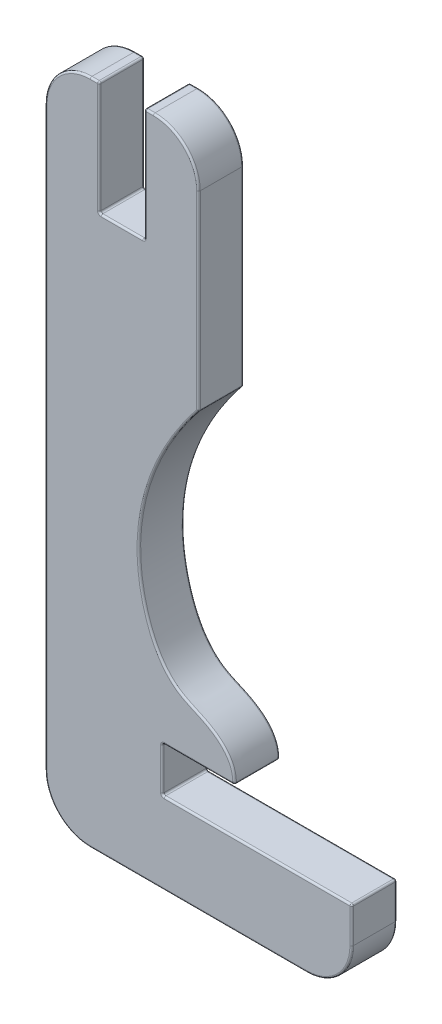
from build123d import *

# Parameters (mm, degrees)
RESSALTO_EXTRUS_O1_DEPTH = 2.5
FILETE1_R                = 0.1


with BuildPart() as part:
    # Esboço1 → Ressalto-extrusão1 (new body)
    with BuildSketch(Plane.XY):
        with BuildLine():
            Line((-99.459703088, 15.410981147), (-99.459703088, 4.861348653))
            add(Edge.make_bspline(
                [(-97.459703088, -12.089018853), (-97.404624741, -10.991450722), (-98.658271178, -9.90481113), (-101.30414524, -8.990765832), (-103.915821362, -3.231494779), (-101.9905843, 1.708849959), (-99.459703088, 4.861348653)],
                knots=[0, 0, 0, 0, 0.150348542, 0.226705439, 0.420401921, 1, 1, 1, 1], degree=3))
            Line((-97.459703088, -12.089018853), (-101.459703088, -12.089018853))
            Line((-101.459703088, -12.089018853), (-101.459703088, -14.589018853))
            Line((-101.459703088, -14.589018853), (-90.959703088, -14.589018853))
            Line((-90.959703088, -14.589018853), (-90.959703088, -16.589018853))
            ThreePointArc((-90.959703088, -16.589018853), (-91.691936135, -18.356785806), (-93.459703088, -19.089018853))
            Line((-93.459703088, -19.089018853), (-105.459703088, -19.089018853))
            ThreePointArc((-105.459703088, -19.089018853), (-107.227470041, -18.356785806), (-107.959703088, -16.589018853))
            Line((-107.959703088, -16.589018853), (-107.959703088, 15.410981147))
            ThreePointArc((-107.959703088, 15.410981147), (-107.227470041, 17.1787481), (-105.459703088, 17.910981147))
            Line((-105.459703088, 17.910981147), (-104.959703088, 17.910981147))
            Line((-104.959703088, 17.910981147), (-104.959703088, 11.610981147))
            Line((-104.959703088, 11.610981147), (-102.459703088, 11.610981147))
            Line((-102.459703088, 11.610981147), (-102.459703088, 17.910981147))
            Line((-102.459703088, 17.910981147), (-101.959703088, 17.910981147))
            ThreePointArc((-101.959703088, 17.910981147), (-100.191936135, 17.1787481), (-99.459703088, 15.410981147))
        make_face()
    extrude(amount=RESSALTO_EXTRUS_O1_DEPTH)

    # Filete1
    filete1_edges = [part.edges().sort_by_distance(p)[0] for p in [
        (-102.459703088, 14.760981147, 2.5),
        (-103.709703088, 11.610981147, 2.5),
        (-99.459703088, 10.1361649, 0),
        (-102.723921949, -4.322739517, 0),
        (-99.459703088, -12.089018853, 0),
        (-104.959703088, 14.760981147, 2.5),
        (-101.459703088, -13.339018853, 0),
        (-96.209703088, -14.589018853, 0),
        (-90.959703088, -15.589018853, 0),
        (-91.691936135, -18.356785806, 0),
        (-99.459703088, -19.089018853, 0),
        (-107.227470041, -18.356785806, 0),
        (-107.959703088, -0.589018853, 0),
        (-107.227470041, 17.1787481, 0),
        (-105.209703088, 17.910981147, 2.5),
        (-105.209703088, 17.910981147, 0),
        (-104.959703088, 14.760981147, 0),
        (-103.709703088, 11.610981147, 0),
        (-102.459703088, 14.760981147, 0),
        (-102.209703088, 17.910981147, 0),
        (-100.191936135, 17.1787481, 0),
        (-107.227470041, 17.1787481, 2.5),
        (-107.959703088, -0.589018853, 2.5),
        (-99.459703088, 4.861348653, 1.25),
        (-97.459703088, -12.089018853, 1.25),
        (-101.459703088, -12.089018853, 1.25),
        (-101.459703088, -14.589018853, 1.25),
        (-90.959703088, -14.589018853, 1.25),
        (-107.227470041, -18.356785806, 2.5),
        (-104.959703088, 17.910981147, 1.25),
        (-104.959703088, 11.610981147, 1.25),
        (-102.459703088, 11.610981147, 1.25),
        (-102.459703088, 17.910981147, 1.25),
        (-99.459703088, -19.089018853, 2.5),
        (-91.691936135, -18.356785806, 2.5),
        (-90.959703088, -15.589018853, 2.5),
        (-100.191936135, 17.1787481, 2.5),
        (-96.209703088, -14.589018853, 2.5),
        (-101.459703088, -13.339018853, 2.5),
        (-99.459703088, -12.089018853, 2.5),
        (-102.723921949, -4.322739517, 2.5),
        (-99.459703088, 10.1361649, 2.5),
        (-102.209703088, 17.910981147, 2.5),
    ]]
    fillet(filete1_edges, radius=FILETE1_R)


solid = part.part
